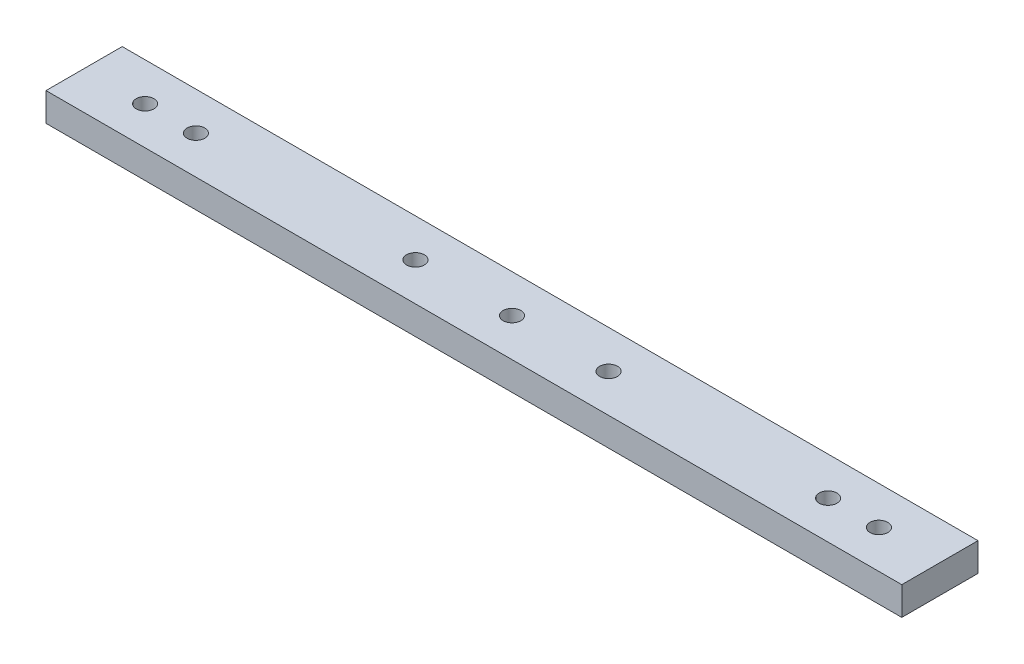
from build123d import *

# Parameters (mm, degrees)
SKETCH1_W           = 168.412
SKETCH1_H           = 15
BOSS_EXTRUDE1_DEPTH = 5.588
SKETCH2_R           = 1.75
CUT_EXTRUDE1_DEPTH  = 98.959199068
SKETCH3_R           = 1.75
CUT_EXTRUDE2_DEPTH  = 98.959199068


with BuildPart() as part:
    # Sketch1 → Boss-Extrude1 (new body)
    with BuildSketch(Plane(origin=(0, 0, 0), x_dir=(1, 0, 0), z_dir=(0, 1, 0))):
        with Locations((12.851084959, 4.52918108)):
            Rectangle(SKETCH1_W, SKETCH1_H)
    extrude(amount=BOSS_EXTRUDE1_DEPTH)

    # Sketch2 → Cut-Extrude1 (cut, through all)
    with BuildSketch(Plane(origin=(0, 5.588, 0), x_dir=(1, 0, 0), z_dir=(0, 1, 0))):
        with Locations(Location((-59.354915041, 4.52918108, 0), (0, 0, 270))):
            Circle(SKETCH2_R)
        with Locations(Location((-49.354915041, 4.52918108, 0), (0, 0, 270))):
            Circle(SKETCH2_R)
        with Locations(Location((75.057084959, 4.52918108, 0), (0, 0, 270))):
            Circle(SKETCH2_R)
        with Locations(Location((85.057084959, 4.52918108, 0), (0, 0, 270))):
            Circle(SKETCH2_R)
    extrude(amount=-CUT_EXTRUDE1_DEPTH, mode=Mode.SUBTRACT)

    # Sketch3 → Cut-Extrude2 (cut, through all)
    with BuildSketch(Plane(origin=(0, 5.588, 0), x_dir=(1, 0, 0), z_dir=(0, 1, 0))):
        with Locations(Location((-6.148915041, 4.52918108, 0), (0, 0, 270))):
            Circle(SKETCH3_R)
        with Locations(Location((31.851084959, 4.52918108, 0), (0, 0, 270))):
            Circle(SKETCH3_R)
        with Locations(Location((12.851084959, 4.52918108, 0), (0, 0, 270))):
            Circle(SKETCH3_R)
    extrude(amount=-CUT_EXTRUDE2_DEPTH, mode=Mode.SUBTRACT)


solid = part.part
